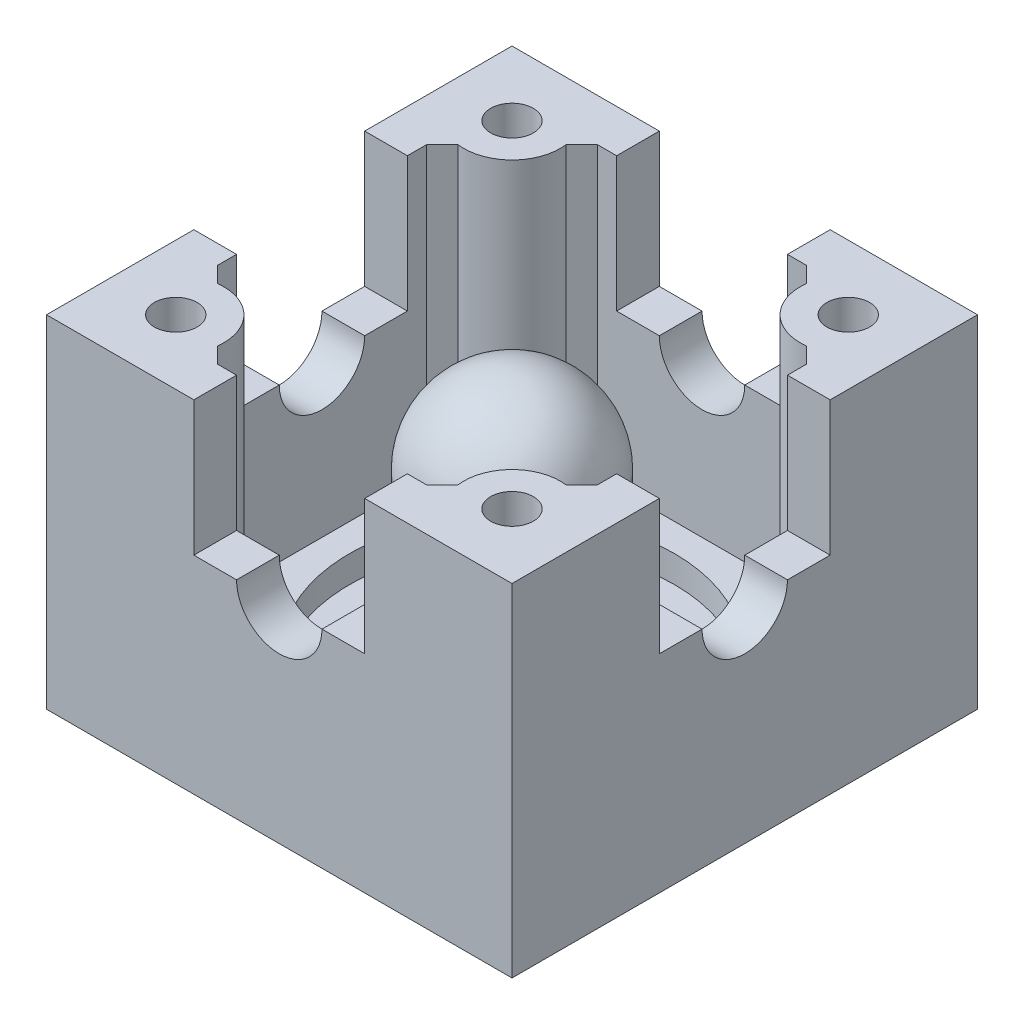
from build123d import *

# Parameters (mm, degrees)
SKETCH1_W                     = 13.843
SKETCH1_H                     = 13.843
MAIN_BODY_EXTRUDE_DEPTH       = 10.16
MAIN_BODY_CUT_DEPTH           = 9.36
SKETCH21_R                    = 0.635
SCREW_HOLES_CUT_DEPTH         = 23.056357315
X_AXIS_SLOT_DEPTH             = 23.056357315
SKETCH6_W                     = 5.08
SKETCH6_H                     = 6.485700116
Y_AXIS_SLOT_DEPTH             = 23.056357315
SPRING_START                  = 0.8
SKETCH11_W                    = 11.303
SKETCH11_H                    = 11.303
SKETCH11_R                    = 4.826
SKETCH11_R_2                  = 0.635
SPRING_RETAINER_EXTRUDE_DEPTH = 0.8
SKETCH12_R                    = 2.54
STICK_SUPPORT_DEPTH           = 5.3595
SKETCH20_R                    = 2.54
BOSS_EXTRUDE9_DEPTH           = 2.54
FILLET4_R                     = 2.54


with BuildPart() as part:
    # Sketch1 → main body extrude (new body)
    with BuildSketch(Plane(origin=(0, 0, 0), x_dir=(1, 0, 0), z_dir=(0, 1, 0))):
        with Locations((6.9215, 6.9215)):
            Rectangle(SKETCH1_W, SKETCH1_H)
    extrude(amount=MAIN_BODY_EXTRUDE_DEPTH)

    # Sketch4 → main body cut (cut)
    with BuildSketch(Plane(origin=(0, 10.16, 0), x_dir=(1, 0, 0), z_dir=(0, 1, 0))):
        with BuildLine():
            Line((1.735593231, 10.498593231), (1.27, 10.033))
            Line((1.27, 10.033), (1.27, 3.81))
            Line((1.27, 3.81), (1.735593231, 3.344406769))
            ThreePointArc((1.735593231, 3.344406769), (2.868191287, 2.999925058), (3.3565, 1.9215))
            ThreePointArc((3.3565, 1.9215), (3.353473501, 1.828350157), (3.344406769, 1.735593231))
            Line((3.344406769, 1.735593231), (3.81, 1.27))
            Line((3.81, 1.27), (10.033, 1.27))
            Line((10.033, 1.27), (10.498593231, 1.735593231))
            ThreePointArc((10.498593231, 1.735593231), (10.906801769, 2.936198231), (12.107406769, 3.344406769))
            Line((12.107406769, 3.344406769), (12.573, 3.81))
            Line((12.573, 3.81), (12.573, 10.033))
            Line((12.573, 10.033), (12.107406769, 10.498593231))
            ThreePointArc((12.107406769, 10.498593231), (10.906801769, 10.906801769), (10.498593231, 12.107406769))
            Line((10.498593231, 12.107406769), (10.033, 12.573))
            Line((10.033, 12.573), (3.81, 12.573))
            Line((3.81, 12.573), (3.344406769, 12.107406769))
            ThreePointArc((3.344406769, 12.107406769), (3.353473501, 12.014649843), (3.3565, 11.9215))
            ThreePointArc((3.3565, 11.9215), (2.868191287, 10.843074942), (1.735593231, 10.498593231))
        make_face()
    extrude(amount=-MAIN_BODY_CUT_DEPTH, mode=Mode.SUBTRACT)

    # Sketch21 → screw holes cut (cut, through all)
    with BuildSketch(Plane(origin=(0, 10.16, 0), x_dir=(1, 0, 0), z_dir=(0, 1, 0))):
        with Locations(Location((1.9215, 11.9215, 0), (0, 0, 270))):
            Circle(SKETCH21_R)
        with Locations(Location((11.9215, 11.9215, 0), (0, 0, 270))):
            Circle(SKETCH21_R)
        with Locations(Location((11.9215, 1.9215, 0), (0, 0, 270))):
            Circle(SKETCH21_R)
        with Locations(Location((1.9215, 1.9215, 0), (0, 0, 270))):
            Circle(SKETCH21_R)
    extrude(amount=-SCREW_HOLES_CUT_DEPTH, mode=Mode.SUBTRACT)

    # Sketch5 → x axis slot (cut, through all)
    with BuildSketch(Plane.XY):
        with BuildLine():
            Line((9.4615, 12.711621125), (4.3815, 12.711621125))
            Line((4.3815, 12.711621125), (4.3815, 6.1595))
            Line((4.3815, 6.1595), (5.6515, 6.1595))
            ThreePointArc((5.6515, 6.1595), (6.9215, 4.8895), (8.1915, 6.1595))
            Line((8.1915, 6.1595), (9.4615, 6.1595))
            Line((9.4615, 6.1595), (9.4615, 12.711621125))
        make_face()
    extrude(amount=-X_AXIS_SLOT_DEPTH, mode=Mode.SUBTRACT)

    # Sketch6 → y axis slot (cut, through all)
    with BuildSketch(Plane(origin=(13.843, 0, 0), x_dir=(0, 0, -1), z_dir=(1, 0, 0))):
        with BuildLine():
            Line((5.6515, 6.1595), (5.6515, 12.645200116))
            ThreePointArc((5.6515, 12.645200116), (6.9215, 13.915200116), (8.1915, 12.645200116))
            Line((8.1915, 12.645200116), (8.1915, 6.1595))
            ThreePointArc((8.1915, 6.1595), (6.9215, 4.8895), (5.6515, 6.1595))
        make_face()
        with Locations((6.9215, 9.402350058)):
            Rectangle(SKETCH6_W, SKETCH6_H)
    extrude(amount=-Y_AXIS_SLOT_DEPTH, mode=Mode.SUBTRACT)

    # Sketch11 → spring retainer extrude (add)
    with BuildSketch(Plane(origin=(0, 0.8, 0), x_dir=(1, 0, 0), z_dir=(0, 1, 0)).offset(SPRING_START)):
        with Locations((6.9215, 6.9215)):
            Rectangle(SKETCH11_W, SKETCH11_H)
        with Locations(Location((6.9215, 6.9215, 0), (0, 0, 270))):
            Circle(SKETCH11_R, mode=Mode.SUBTRACT)
        with Locations(Location((1.9215, 11.9215, 0), (0, 0, 270))):
            Circle(SKETCH11_R_2, mode=Mode.SUBTRACT)
        with Locations(Location((11.9215, 11.9215, 0), (0, 0, 270))):
            Circle(SKETCH11_R_2, mode=Mode.SUBTRACT)
        with Locations(Location((11.9215, 1.9215, 0), (0, 0, 270))):
            Circle(SKETCH11_R_2, mode=Mode.SUBTRACT)
        with Locations(Location((1.9215, 1.9215, 0), (0, 0, 270))):
            Circle(SKETCH11_R_2, mode=Mode.SUBTRACT)
    extrude(amount=-SPRING_RETAINER_EXTRUDE_DEPTH)

    # Sketch12 → Stick support (add)
    with BuildSketch(Plane(origin=(0, 0.8, 0), x_dir=(1, 0, 0), z_dir=(0, 1, 0))):
        with Locations(Location((6.9215, 6.9215, 0), (0, 0, 90))):
            Circle(SKETCH12_R)
    extrude(amount=STICK_SUPPORT_DEPTH)

    # Sketch20 → Boss-Extrude9 (add)
    with BuildSketch(Plane(origin=(0, 6.1595, 0), x_dir=(1, 0, 0), z_dir=(0, 1, 0))):
        with Locations(Location((6.9215, 6.9215, 0), (0, 0, 90))):
            Circle(SKETCH20_R)
    extrude(amount=BOSS_EXTRUDE9_DEPTH)

    # Fillet4
    fillet4_edges = [part.edges().sort_by_distance(p)[0] for p in [
        (6.9215, 8.6995, -4.3815),
    ]]
    fillet(fillet4_edges, radius=FILLET4_R)


solid = part.part
